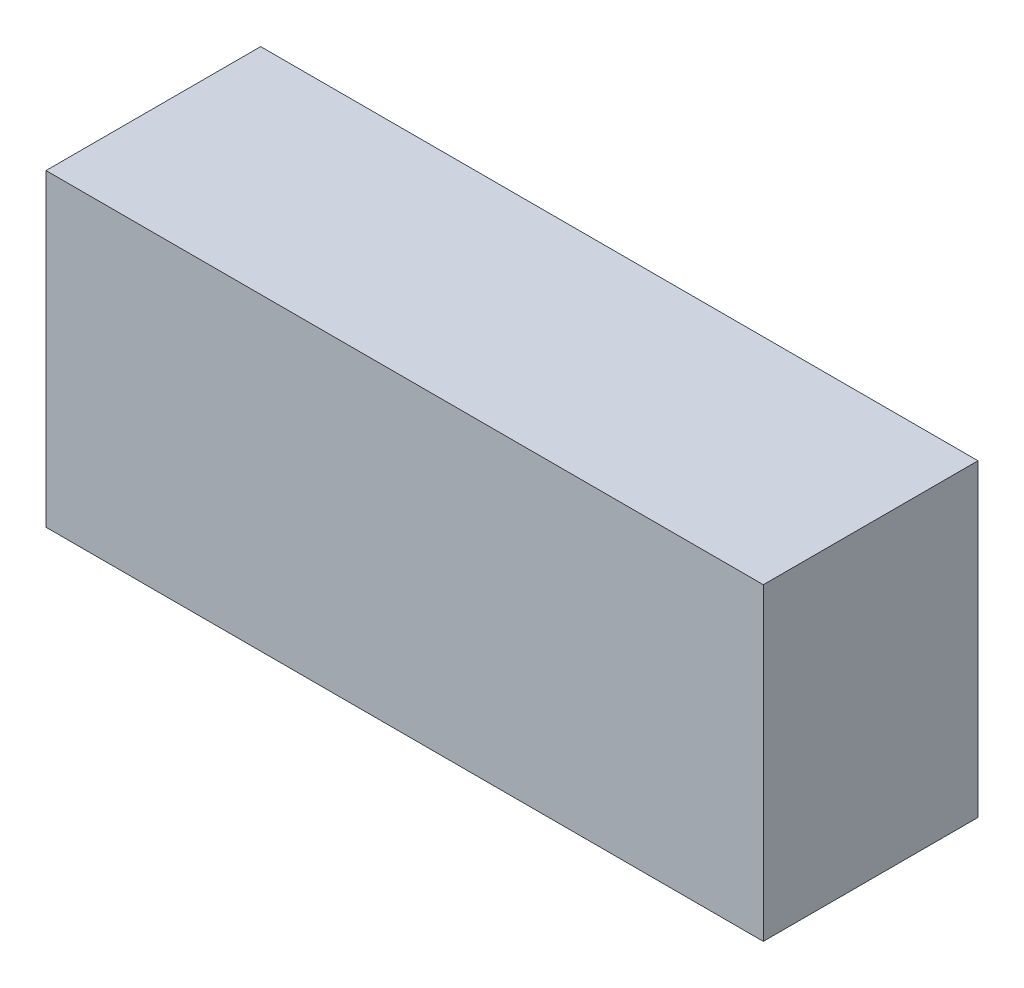
from build123d import *

# Parameters (mm, degrees)
SKETCH_1_W      = 137
SKETCH_1_H      = 41
EXTRUDE_1_DEPTH = 59


with BuildPart() as part:
    # 草图1 → 凸台-拉伸1 (new body)
    with BuildSketch(Plane(origin=(0, 0, 0), x_dir=(1, 0, 0), z_dir=(0, 1, 0))):
        Rectangle(SKETCH_1_W, SKETCH_1_H)
    extrude(amount=EXTRUDE_1_DEPTH)


solid = part.part
